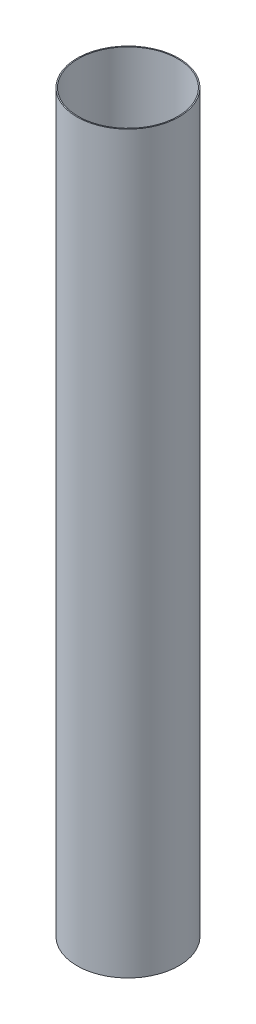
from build123d import *

# Parameters (mm, degrees)
SKETCH5_R           = 49.276
SKETCH5_R_2         = 48.26
BOSS_EXTRUDE1_DEPTH = 711.2


with BuildPart() as part:
    # Sketch5 → Boss-Extrude1 (new body)
    with BuildSketch(Plane(origin=(0, 0, 0), x_dir=(1, 0, 0), z_dir=(0, 1, 0))):
        with Locations(Location((0, 0, 0), (0, 0, 270))):
            Circle(SKETCH5_R)
        with Locations(Location((0, 0, 0), (0, 0, 270))):
            Circle(SKETCH5_R_2, mode=Mode.SUBTRACT)
    extrude(amount=-BOSS_EXTRUDE1_DEPTH)


solid = part.part
